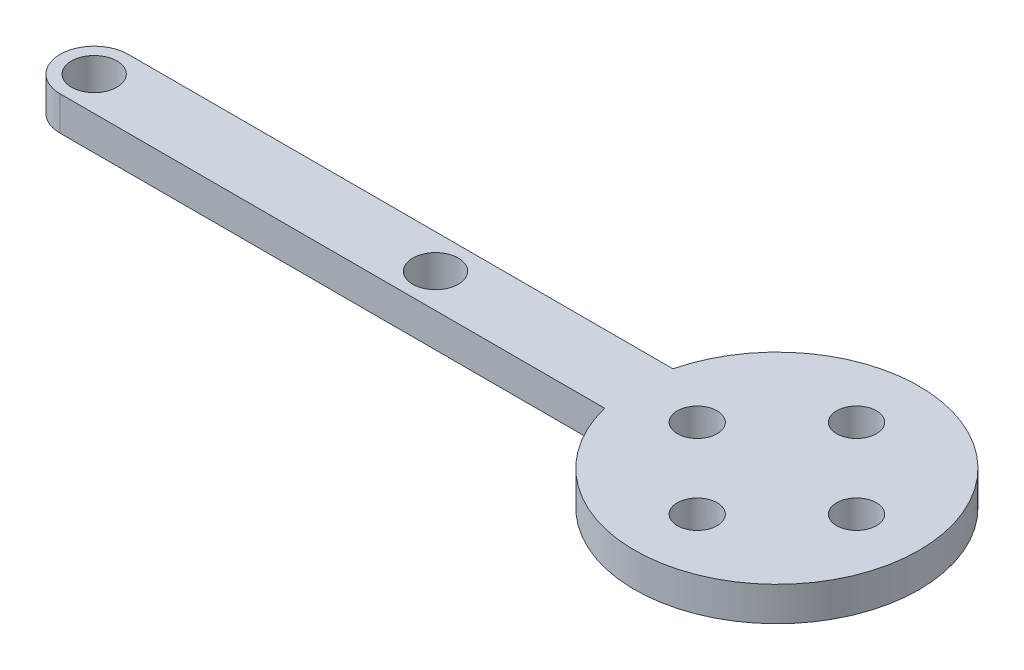
from build123d import *

# Parameters (mm, degrees)
SKETCH_1_R      = 1.75
SKETCH_1_R_2    = 2
EXTRUDE_1_DEPTH = 3


with BuildPart() as part:
    # 草图1 → 凸台-拉伸1 (new body)
    with BuildSketch(Plane(origin=(0, 0, 0), x_dir=(1, 0, 0), z_dir=(0, 1, 0))):
        with BuildLine():
            Line((-12.1346611, -3), (-60, -3))
            ThreePointArc((-60, -3), (-63, 0), (-60, 3))
            Line((-60, 3), (-12.1346611, 3))
            ThreePointArc((-12.1346611, 3), (12.5, 0), (-12.1346611, -3))
        make_face()
        with Locations(Location((0, 7, 0), (0, 0, 270))):
            Circle(SKETCH_1_R, mode=Mode.SUBTRACT)
        with Locations(Location((7, 0, 0), (0, 0, 270))):
            Circle(SKETCH_1_R, mode=Mode.SUBTRACT)
        with Locations(Location((0, -7, 0), (0, 0, 270))):
            Circle(SKETCH_1_R, mode=Mode.SUBTRACT)
        with Locations(Location((-7, 0, 0), (0, 0, 270))):
            Circle(SKETCH_1_R, mode=Mode.SUBTRACT)
        with Locations(Location((-60, 0, 0), (0, 0, 270))):
            Circle(SKETCH_1_R_2, mode=Mode.SUBTRACT)
        with Locations(Location((-30, 0, 0), (0, 0, 270))):
            Circle(SKETCH_1_R_2, mode=Mode.SUBTRACT)
    extrude(amount=EXTRUDE_1_DEPTH)


solid = part.part
